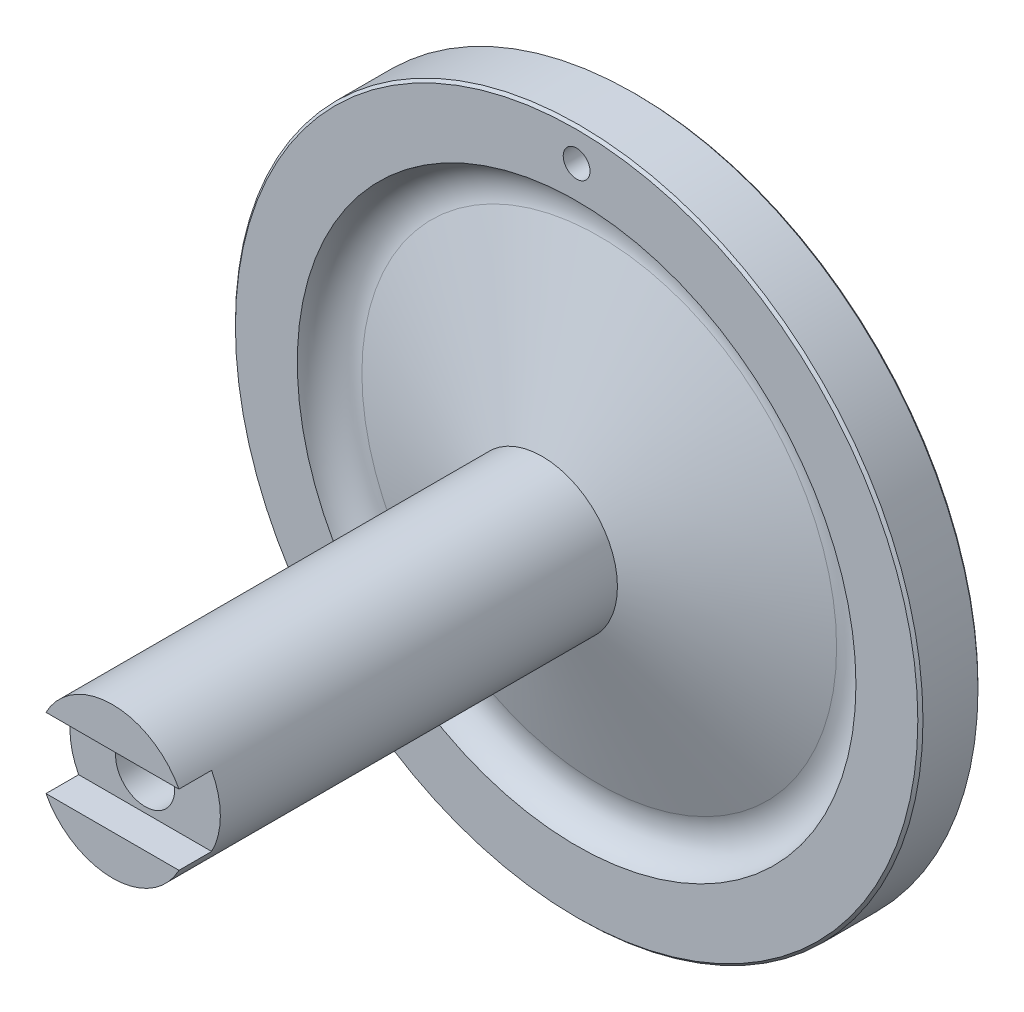
from build123d import *

# Parameters (mm, degrees)
CHAMFER1_SIZE           = 0.762
CUT_EXTRUDE1_DEPTH      = 212.309071268
CUT_EXTRUDE1_DEPTH_BACK = 212.309071268
SKETCH2_W               = 9.652
SKETCH2_H               = 20.7772
SKETCH3_R               = 3.9624
CUT_EXTRUDE2_DEPTH      = 212.309071268


with BuildPart() as part:
    # Sketch1 → Revolve1 (revolve)
    with BuildSketch(Plane(origin=(0, 0, 0), x_dir=(0, 0, -1), z_dir=(1, 0, 0)), mode=Mode.PRIVATE) as revolve1_sk:
        with BuildLine():
            Line((0, 8.7376), (0, 22.225))
            Line((0, 22.225), (127, 22.225))
            Line((127, 22.225), (143.848351765, 70.147009334))
            ThreePointArc((143.848351765, 70.147009334), (143.246247988, 77.827175683), (137.16, 82.55))
            Line((137.16, 82.55), (137.16, 101.6))
            Line((137.16, 101.6), (154.94, 101.6))
            Line((154.94, 101.6), (154.94, 82.55))
            Line((154.94, 82.55), (137.804544362, 33.811376987))
            ThreePointArc((137.804544362, 33.811376987), (137.434535895, 28.864946582), (139.601754698, 24.403193264))
            Line((139.601754698, 24.403193264), (147.0152, 15.875))
            Line((147.0152, 15.875), (147.0152, 8.7376))
            Line((147.0152, 8.7376), (0, 8.7376))
        make_face()
    revolve(revolve1_sk.sketch.rotate(Axis((0, 0, 0), (0, 0, -1)), 90), axis=Axis((0, 0, 0), (0, 0, -1)))

    # Chamfer1
    chamfer1_edges = [part.edges().sort_by_distance(p)[0] for p in [
        (-101.6, 0, -154.94),
        (-101.6, 0, -137.16),
    ]]
    chamfer(chamfer1_edges, length=CHAMFER1_SIZE)

    # Sketch2 → Cut-Extrude1 (cut, two sides: drawn at the far end of the back side and taken through both)
    with BuildSketch(Plane(origin=(0, 0, 0), x_dir=(0, 0, -1), z_dir=(1, 0, 0)).offset(-CUT_EXTRUDE1_DEPTH_BACK)):
        with Locations((4.826, 0)):
            Rectangle(SKETCH2_W, SKETCH2_H)
    extrude(amount=CUT_EXTRUDE1_DEPTH + CUT_EXTRUDE1_DEPTH_BACK, mode=Mode.SUBTRACT)

    # Sketch3 → Cut-Extrude2 (cut, through all)
    with BuildSketch(Plane(origin=(0, 0, -154.94), x_dir=(-1, 0, 0), z_dir=(0, 0, -1))):
        with Locations((0, 92.075)):
            Circle(SKETCH3_R)
    extrude(amount=-CUT_EXTRUDE2_DEPTH, mode=Mode.SUBTRACT)


solid = part.part
